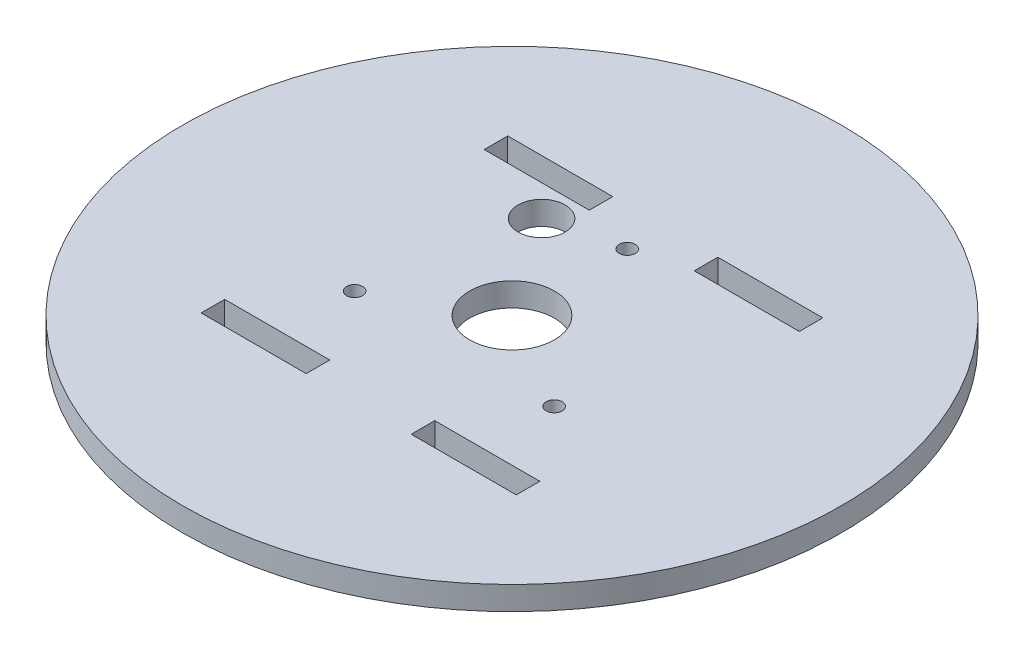
from build123d import *

# Parameters (mm, degrees)
SKETCH1_R            = 88.9
SKETCH1_R_2          = 11.43
SKETCH1_R_3          = 2.159
SKETCH1_R_4          = 6.35
BODY_DEPTH           = 6.35
MOUNTING_TEETH_REACH = 127.884
SKETCH2_W            = 28.333333333
SKETCH2_H            = 6.35


with BuildPart() as part:
    # Sketch1 → Body (new body)
    with BuildSketch(Plane(origin=(0, 0, 0), x_dir=(1, 0, 0), z_dir=(0, 1, 0))):
        with Locations(Location((0, 0, 0), (0, 0, 270))):
            Circle(SKETCH1_R)
        with Locations(Location((0, 0, 0), (0, 0, 270))):
            Circle(SKETCH1_R_2, mode=Mode.SUBTRACT)
        with Locations(Location((0, 31.089, 0), (0, 0, 270))):
            Circle(SKETCH1_R_3, mode=Mode.SUBTRACT)
        with Locations(Location((26.923863778, -15.5445, 0), (0, 0, 270))):
            Circle(SKETCH1_R_3, mode=Mode.SUBTRACT)
        with Locations(Location((-26.923863778, -15.5445, 0), (0, 0, 270))):
            Circle(SKETCH1_R_3, mode=Mode.SUBTRACT)
        with Locations(Location((-18.648117099, 26.632271264, 0), (0, 0, 270))):
            Circle(SKETCH1_R_4, mode=Mode.SUBTRACT)
    extrude(amount=BODY_DEPTH)

    # Sketch2 → Mounting teeth (cut, up to next)
    with BuildSketch(Plane(origin=(0, 6.35, 0), x_dir=(1, 0, 0), z_dir=(0, 1, 0)), mode=Mode.PRIVATE) as mounting_teeth_sk1:
        with Locations((-28.333333334, 38.175)):
            Rectangle(SKETCH2_W, SKETCH2_H)
    mounting_teeth_tool1 = extrude(mounting_teeth_sk1.sketch, amount=-MOUNTING_TEETH_REACH, mode=Mode.PRIVATE) & part.part
    # Sketch2 → Mounting teeth (cut, up to next)
    with BuildSketch(Plane(origin=(0, 6.35, 0), x_dir=(1, 0, 0), z_dir=(0, 1, 0)), mode=Mode.PRIVATE) as mounting_teeth_sk2:
        with Locations((28.333333334, 38.175)):
            Rectangle(SKETCH2_W, SKETCH2_H)
    mounting_teeth_tool2 = extrude(mounting_teeth_sk2.sketch, amount=-MOUNTING_TEETH_REACH, mode=Mode.PRIVATE) & part.part
    # Sketch2 → Mounting teeth (cut, up to next)
    with BuildSketch(Plane(origin=(0, 6.35, 0), x_dir=(1, 0, 0), z_dir=(0, 1, 0)), mode=Mode.PRIVATE) as mounting_teeth_sk3:
        with Locations((28.333333334, -38.175)):
            Rectangle(SKETCH2_W, SKETCH2_H)
    mounting_teeth_tool3 = extrude(mounting_teeth_sk3.sketch, amount=-MOUNTING_TEETH_REACH, mode=Mode.PRIVATE) & part.part
    # Sketch2 → Mounting teeth (cut, up to next)
    with BuildSketch(Plane(origin=(0, 6.35, 0), x_dir=(1, 0, 0), z_dir=(0, 1, 0)), mode=Mode.PRIVATE) as mounting_teeth_sk4:
        with Locations((-28.333333334, -38.175)):
            Rectangle(SKETCH2_W, SKETCH2_H)
    mounting_teeth_tool4 = extrude(mounting_teeth_sk4.sketch, amount=-MOUNTING_TEETH_REACH, mode=Mode.PRIVATE) & part.part
    add(mounting_teeth_tool1.solids().sort_by_distance((-28.333333, 6.35, -38.175))[0], mode=Mode.SUBTRACT)
    add(mounting_teeth_tool2.solids().sort_by_distance((28.333333, 6.35, -38.175))[0], mode=Mode.SUBTRACT)
    add(mounting_teeth_tool3.solids().sort_by_distance((28.333333, 6.35, 38.175))[0], mode=Mode.SUBTRACT)
    add(mounting_teeth_tool4.solids().sort_by_distance((-28.333333, 6.35, 38.175))[0], mode=Mode.SUBTRACT)


solid = part.part
